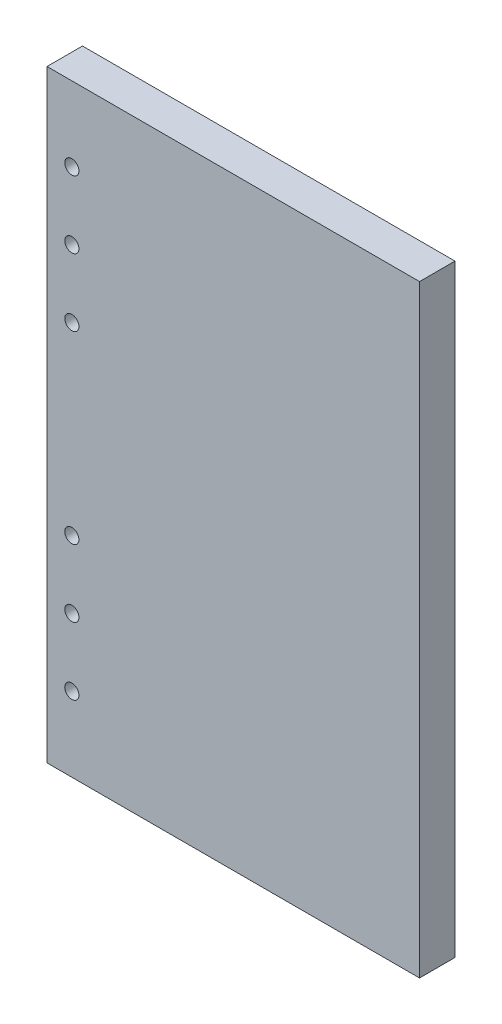
from build123d import *

# Parameters (mm, degrees)
SKETCH_1_W      = 105
SKETCH_1_H      = 170
SKETCH_1_R      = 2
EXTRUDE_1_DEPTH = 10


with BuildPart() as part:
    # Эскиз1 → Бобышка-Вытянуть1 (new body)
    with BuildSketch(Plane.XY):
        with Locations((52.5, 85)):
            Rectangle(SKETCH_1_W, SKETCH_1_H)
        with Locations((7, 111)):
            Circle(SKETCH_1_R, mode=Mode.SUBTRACT)
        with Locations((7, 130)):
            Circle(SKETCH_1_R, mode=Mode.SUBTRACT)
        with Locations((7, 149)):
            Circle(SKETCH_1_R, mode=Mode.SUBTRACT)
        with Locations(Location((7, 21, 0), (0, 0, 180))):
            Circle(SKETCH_1_R, mode=Mode.SUBTRACT)
        with Locations(Location((7, 40, 0), (0, 0, 180))):
            Circle(SKETCH_1_R, mode=Mode.SUBTRACT)
        with Locations(Location((7, 59, 0), (0, 0, 180))):
            Circle(SKETCH_1_R, mode=Mode.SUBTRACT)
    extrude(amount=EXTRUDE_1_DEPTH)


solid = part.part
